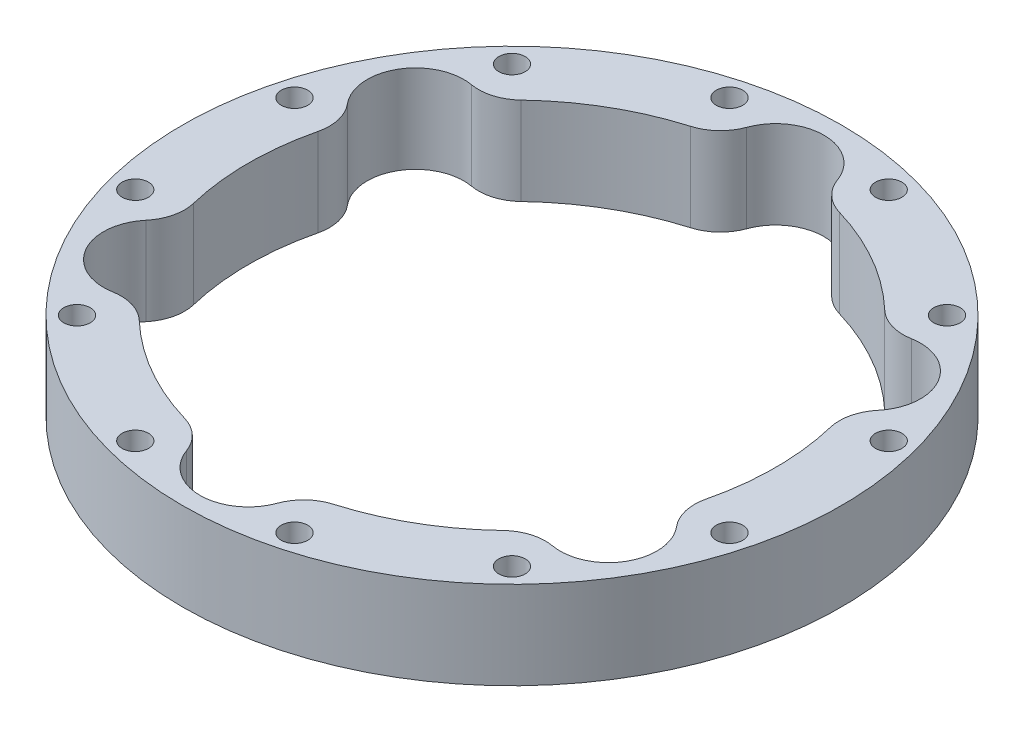
from build123d import *

# Parameters (mm, degrees)
SKETCH1_R           = 37.5
SKETCH1_R_2         = 1.5
BOSS_EXTRUDE1_DEPTH = 10
FILLET1_R           = 5


with BuildPart() as part:
    # Sketch1 → Boss-Extrude1 (new body)
    with BuildSketch(Plane(origin=(0, 0, 0), x_dir=(1, 0, 0), z_dir=(0, 1, 0))):
        with Locations(Location((0, 0, 0), (0, 0, 270))):
            Circle(SKETCH1_R)
        with Locations(Location((-24.748737342, -24.748737342, 0), (0, 0, 270))):
            Circle(SKETCH1_R_2, mode=Mode.SUBTRACT)
        with Locations(Location((-9.058666579, -33.80740392, 0), (0, 0, 270))):
            Circle(SKETCH1_R_2, mode=Mode.SUBTRACT)
        with Locations(Location((-33.80740392, -9.058666579, 0), (0, 0, 270))):
            Circle(SKETCH1_R_2, mode=Mode.SUBTRACT)
        with Locations(Location((9.058666579, -33.80740392, 0), (0, 0, 270))):
            Circle(SKETCH1_R_2, mode=Mode.SUBTRACT)
        with Locations(Location((24.748737342, -24.748737342, 0), (0, 0, 270))):
            Circle(SKETCH1_R_2, mode=Mode.SUBTRACT)
        with Locations(Location((33.80740392, -9.058666579, 0), (0, 0, 270))):
            Circle(SKETCH1_R_2, mode=Mode.SUBTRACT)
        with Locations(Location((-33.80740392, 9.058666579, 0), (0, 0, 270))):
            Circle(SKETCH1_R_2, mode=Mode.SUBTRACT)
        with Locations(Location((-24.748737342, 24.748737342, 0), (0, 0, 270))):
            Circle(SKETCH1_R_2, mode=Mode.SUBTRACT)
        with Locations(Location((-9.058666579, 33.80740392, 0), (0, 0, 270))):
            Circle(SKETCH1_R_2, mode=Mode.SUBTRACT)
        with BuildLine():
            ThreePointArc((28.282562779, 10.004830964), (29.567523428, 5.075584529), (30, 0))
            ThreePointArc((30, 0), (29.567523428, -5.075584529), (28.282562779, -10.004830964))
            ThreePointArc((28.282562779, -10.004830964), (30.612711145, -12.034355354), (31.480762114, -15))
            ThreePointArc((31.480762114, -15), (28.509325321, -19.884298118), (22.805719165, -19.491002369))
            ThreePointArc((22.805719165, -19.491002369), (15, -25.980762114), (5.476843614, -29.495833333))
            ThreePointArc((5.476843614, -29.495833333), (5.494207854, -29.747650913), (5.5, -30))
            ThreePointArc((5.5, -30), (-0.252349087, -35.494207854), (-5.476843614, -29.495833333))
            ThreePointArc((-5.476843614, -29.495833333), (-15, -25.980762114), (-22.805719165, -19.491002369))
            ThreePointArc((-22.805719165, -19.491002369), (-30.743901834, -17.75), (-28.282562779, -10.004830964))
            ThreePointArc((-28.282562779, -10.004830964), (-30, 0), (-28.282562779, 10.004830964))
            ThreePointArc((-28.282562779, 10.004830964), (-30.743901834, 17.75), (-22.805719165, 19.491002369))
            ThreePointArc((-22.805719165, 19.491002369), (-15, 25.980762114), (-5.476843614, 29.495833333))
            ThreePointArc((-5.476843614, 29.495833333), (-0.252349087, 35.494207854), (5.5, 30))
            ThreePointArc((5.5, 30), (5.494207854, 29.747650913), (5.476843614, 29.495833333))
            ThreePointArc((5.476843614, 29.495833333), (15, 25.980762114), (22.805719165, 19.491002369))
            ThreePointArc((22.805719165, 19.491002369), (28.509325321, 19.884298118), (31.480762114, 15))
            ThreePointArc((31.480762114, 15), (30.612711145, 12.034355354), (28.282562779, 10.004830964))
        make_face(mode=Mode.SUBTRACT)
        with Locations(Location((33.80740392, 9.058666579, 0), (0, 0, 270))):
            Circle(SKETCH1_R_2, mode=Mode.SUBTRACT)
        with Locations(Location((9.058666579, 33.80740392, 0), (0, 0, 270))):
            Circle(SKETCH1_R_2, mode=Mode.SUBTRACT)
        with Locations(Location((24.748737342, 24.748737342, 0), (0, 0, 270))):
            Circle(SKETCH1_R_2, mode=Mode.SUBTRACT)
    extrude(amount=BOSS_EXTRUDE1_DEPTH)

    # Fillet1
    fillet1_edges = [part.edges().sort_by_distance(p)[0] for p in [
        (-28.282562779, 5, -10.004830964),
        (-28.282562779, 5, 10.004830964),
        (-22.805719165, 5, 19.491002369),
        (-5.476843614, 5, 29.495833333),
        (5.476843614, 5, 29.495833333),
        (22.805719165, 5, 19.491002369),
        (28.282562779, 5, 10.004830964),
        (28.282562779, 5, -10.004830964),
        (22.805719165, 5, -19.491002369),
        (5.476843614, 5, -29.495833333),
        (-5.476843614, 5, -29.495833333),
        (-22.805719165, 5, -19.491002369),
    ]]
    fillet(fillet1_edges, radius=FILLET1_R)


solid = part.part
